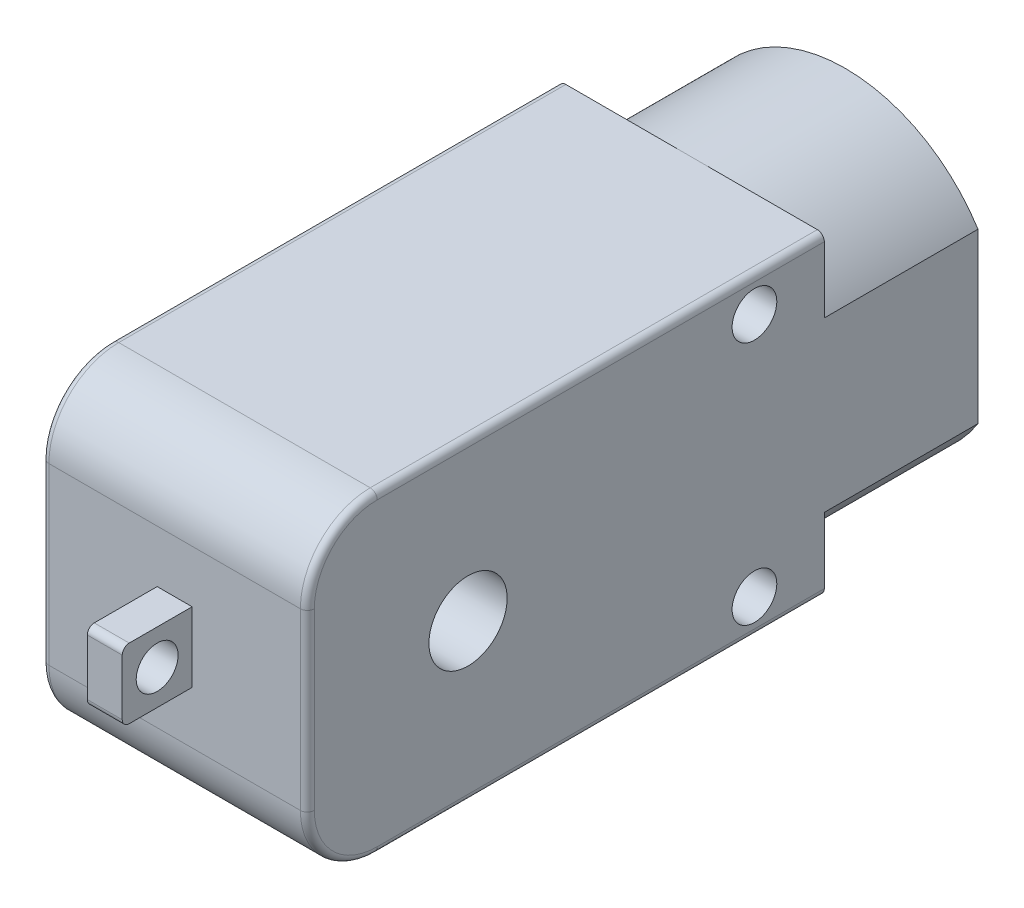
from build123d import *

# Parameters (mm, degrees)
SKETCH1_W           = 19
SKETCH1_H           = 22.5
BOSS_EXTRUDE1_DEPTH = 37
BOSS_EXTRUDE2_DEPTH = 11
FILLET1_R           = 5
SKETCH3_R           = 1.6
CUT_EXTRUDE1_DEPTH  = 44.087846314
SKETCH4_W           = 2.5
SKETCH4_H           = 5
BOSS_EXTRUDE3_DEPTH = 5
FILLET2_R           = 0.5
SKETCH5_R           = 1.5
CUT_EXTRUDE2_DEPTH  = 5
SKETCH6_R           = 2.8
CUT_EXTRUDE3_DEPTH  = 48.450632264
CUT_EXTRUDE4_DEPTH  = 11
SKETCH8_R           = 3
CUT_EXTRUDE5_DEPTH  = 2


with BuildPart() as part:
    # Sketch1 → Boss-Extrude1 (new body)
    with BuildSketch(Plane.XY):
        Rectangle(SKETCH1_W, SKETCH1_H)
    extrude(amount=BOSS_EXTRUDE1_DEPTH)

    # Sketch2 → Boss-Extrude2 (add)
    with BuildSketch(Plane(origin=(0, 0, 0), x_dir=(-1, 0, 0), z_dir=(0, 0, -1))):
        with BuildLine():
            Line((9.5, 6.025985397), (9.5, -6.025985397))
            ThreePointArc((9.5, -6.025985397), (0, -11.25), (-9.5, -6.025985397))
            Line((-9.5, -6.025985397), (-9.5, 6.025985397))
            ThreePointArc((-9.5, 6.025985397), (0, 11.25), (9.5, 6.025985397))
        make_face()
    extrude(amount=BOSS_EXTRUDE2_DEPTH)

    # Fillet1
    fillet1_edges = [part.edges().sort_by_distance(p)[0] for p in [
        (0, 11.25, 37),
        (0, -11.25, 37),
    ]]
    fillet(fillet1_edges, radius=FILLET1_R)

    # Sketch3 → Cut-Extrude1 (cut, through all)
    with BuildSketch(Plane(origin=(9.5, 0, 0), x_dir=(0, 0, -1), z_dir=(1, 0, 0))):
        with Locations(Location((-5, 8.75, 0), (0, 0, 90))):
            Circle(SKETCH3_R)
        with Locations(Location((-5, -8.75, 0), (0, 0, 90))):
            Circle(SKETCH3_R)
    extrude(amount=-CUT_EXTRUDE1_DEPTH, mode=Mode.SUBTRACT)

    # Sketch4 → Boss-Extrude3 (add)
    with BuildSketch(Plane.XY.offset(37)):
        Rectangle(SKETCH4_W, SKETCH4_H)
    extrude(amount=BOSS_EXTRUDE3_DEPTH)

    # Fillet2
    fillet2_edges = [part.edges().sort_by_distance(p)[0] for p in [
        (-9.5, 0, 37),
        (9.5, 0, 37),
        (9.5, 11.25, 16),
        (9.5, -11.25, 16),
        (9.5, 9.785533906, 35.535533906),
        (9.5, -9.785533906, 35.535533906),
        (-9.5, -11.25, 16),
        (-9.5, 11.25, 16),
        (-9.5, 9.785533906, 35.535533906),
        (-9.5, -9.785533906, 35.535533906),
        (0, -2.5, 42),
        (0, 2.5, 42),
    ]]
    fillet(fillet2_edges, radius=FILLET2_R)

    # Sketch5 → Cut-Extrude2 (cut)
    with BuildSketch(Plane(origin=(1.25, 0, 0), x_dir=(0, 0, -1), z_dir=(1, 0, 0))):
        with Locations(Location((-39.5, 0, 0), (0, 0, 90))):
            Circle(SKETCH5_R)
    extrude(amount=-CUT_EXTRUDE2_DEPTH, mode=Mode.SUBTRACT)

    # Sketch6 → Cut-Extrude3 (cut, through all)
    with BuildSketch(Plane(origin=(9.5, 0, 0), x_dir=(0, 0, -1), z_dir=(1, 0, 0))):
        with Locations(Location((-25.5, 0, 0), (0, 0, 90))):
            Circle(SKETCH6_R)
    extrude(amount=-CUT_EXTRUDE3_DEPTH, mode=Mode.SUBTRACT)

    # Sketch7 → Cut-Extrude4 (cut)
    with BuildSketch(Plane(origin=(0, 0, -11), x_dir=(-1, 0, 0), z_dir=(0, 0, -1))):
        with BuildLine():
            Line((-8.3, 5.666789214), (-8.3, -5.666789214))
            ThreePointArc((-8.3, -5.666789214), (0, -10.05), (8.3, -5.666789214))
            Line((8.3, -5.666789214), (8.3, 5.666789214))
            ThreePointArc((8.3, 5.666789214), (0, 10.05), (-8.3, 5.666789214))
        make_face()
    extrude(amount=-CUT_EXTRUDE4_DEPTH, mode=Mode.SUBTRACT)

    # Sketch8 → Cut-Extrude5 (cut)
    with BuildSketch(Plane(origin=(0, 0, 0), x_dir=(-1, 0, 0), z_dir=(0, 0, -1))):
        Circle(SKETCH8_R)
    extrude(amount=-CUT_EXTRUDE5_DEPTH, mode=Mode.SUBTRACT)


solid = part.part
